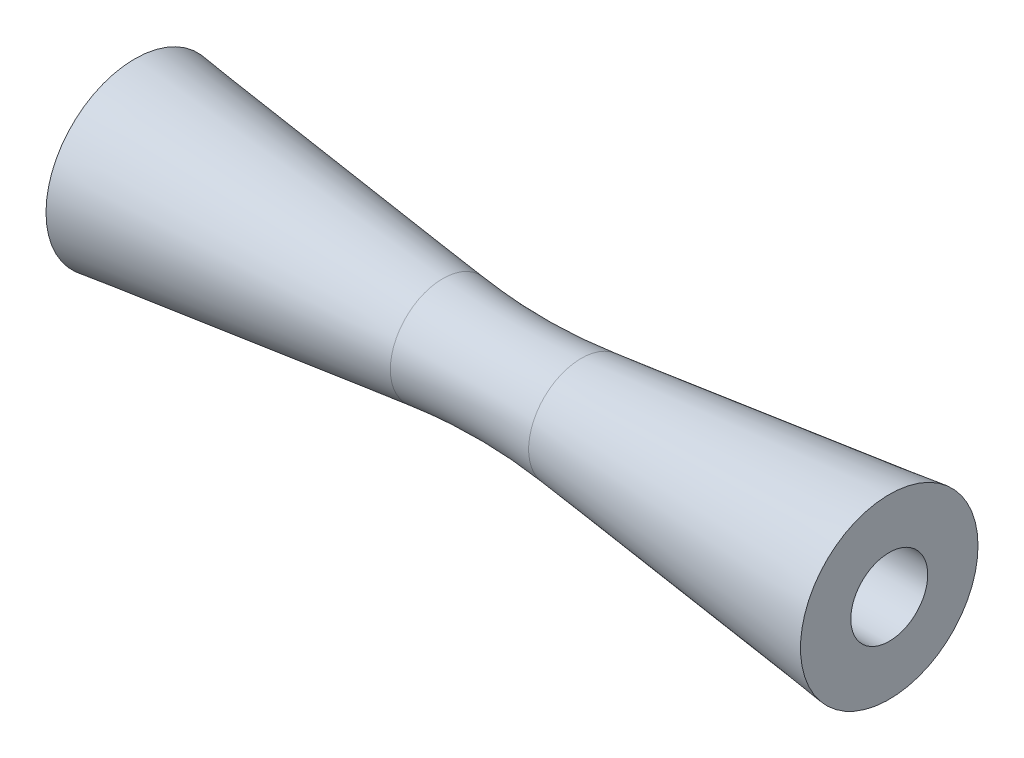
from build123d import *

# Parameters (mm, degrees)
FILLET1_R = 50.8


with BuildPart() as part:
    # Sketch1 → Revolve1 (revolve)
    with BuildSketch(Plane.XY, mode=Mode.PRIVATE) as revolve1_sk:
        Polygon((0, 7.62), (32.385, 3.81), (64.77, 7.62), (64.77, 3.302), (0, 3.302), align=None)
    revolve(revolve1_sk.sketch.rotate(Axis((64.77, 0, 0), (-1, 0, 0)), 90), axis=Axis((64.77, 0, 0), (-1, 0, 0)))

    # Fillet1
    fillet1_edges = [part.edges().sort_by_distance(p)[0] for p in [
        (32.385, 0, 3.81),
    ]]
    fillet(fillet1_edges, radius=FILLET1_R)


solid = part.part
